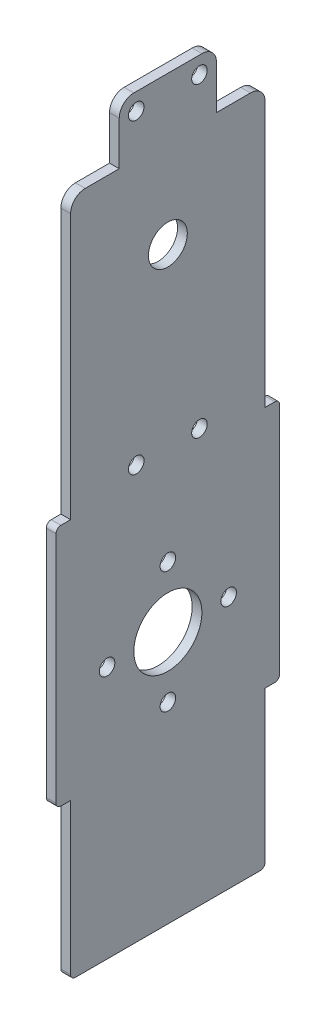
from build123d import *

# Parameters (mm, degrees)
SKETCH_1_W      = 40
SKETCH_1_H      = 139.5
SKETCH_1_R      = 7
SKETCH_1_R_2    = 1.6
SKETCH_1_R_3    = 4
SKETCH_1_W_2    = 20
SKETCH_1_H_2    = 12
SKETCH_1_W_3    = 3
SKETCH_1_H_3    = 50
EXTRUDE_1_DEPTH = 2
FILLET_1_R      = 3
FILLET_2_R      = 1


with BuildPart() as part:
    # 草图1 → 凸台-拉伸1 (new body)
    # profile 1 of 4: a face of its own
    with BuildSketch(Plane(origin=(0, 0, 0), x_dir=(0, 0, -1), z_dir=(1, 0, 0))):
        Rectangle(SKETCH_1_W, SKETCH_1_H)
        with Locations((0, -17.75)):
            Circle(SKETCH_1_R, mode=Mode.SUBTRACT)
        with Locations((0, -5.25)):
            Circle(SKETCH_1_R_2, mode=Mode.SUBTRACT)
        with Locations((12.5, -17.75)):
            Circle(SKETCH_1_R_2, mode=Mode.SUBTRACT)
        with Locations((0, -30.25)):
            Circle(SKETCH_1_R_2, mode=Mode.SUBTRACT)
        with Locations((-12.5, -17.75)):
            Circle(SKETCH_1_R_2, mode=Mode.SUBTRACT)
        with Locations((-6.5, 15.25)):
            Circle(SKETCH_1_R_2, mode=Mode.SUBTRACT)
        with Locations((6.5, 15.25)):
            Circle(SKETCH_1_R_2, mode=Mode.SUBTRACT)
        with Locations((0, 51.25)):
            Circle(SKETCH_1_R_3, mode=Mode.SUBTRACT)
    # profile 2 of 4: a face of its own
    with BuildSketch(Plane(origin=(0, 0, 0), x_dir=(0, 0, -1), z_dir=(1, 0, 0))):
        with Locations((0, 75.75)):
            Rectangle(SKETCH_1_W_2, SKETCH_1_H_2)
        with Locations((-6.5, 78.25)):
            Circle(SKETCH_1_R_2, mode=Mode.SUBTRACT)
        with Locations((6.5, 78.25)):
            Circle(SKETCH_1_R_2, mode=Mode.SUBTRACT)
    # profile 3 of 4: a face of its own
    with BuildSketch(Plane(origin=(0, 0, 0), x_dir=(0, 0, -1), z_dir=(1, 0, 0))):
        with Locations((21.5, -12.75)):
            Rectangle(SKETCH_1_W_3, SKETCH_1_H_3)
    # profile 4 of 4: a face of its own
    with BuildSketch(Plane(origin=(0, 0, 0), x_dir=(0, 0, -1), z_dir=(1, 0, 0))):
        with Locations((-21.5, -12.75)):
            Rectangle(SKETCH_1_W_3, SKETCH_1_H_3)
    extrude(amount=EXTRUDE_1_DEPTH)

    # 圆角1
    fillet_1_edges = [part.edges().sort_by_distance(p)[0] for p in [
        (1, 69.75, 20),
        (1, 81.75, 10),
        (1, 81.75, -10),
        (1, 69.75, -20),
    ]]
    fillet(fillet_1_edges, radius=FILLET_1_R)

    # 圆角2
    fillet_2_edges = [part.edges().sort_by_distance(p)[0] for p in [
        (1, -69.75, 20),
        (1, -37.75, 23),
        (1, 12.25, 23),
        (1, 12.25, -23),
        (1, -37.75, -23),
        (1, -69.75, -20),
    ]]
    fillet(fillet_2_edges, radius=FILLET_2_R)


solid = part.part
